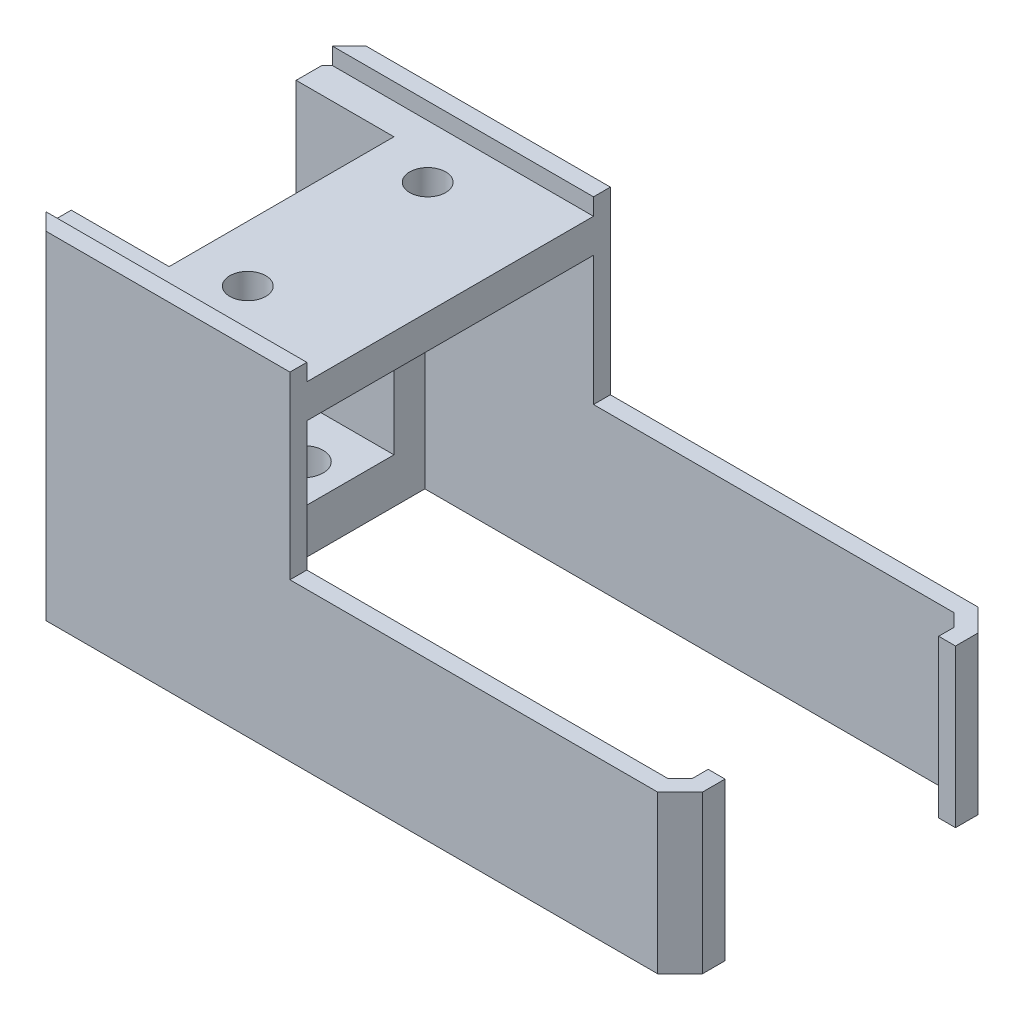
from build123d import *

# Parameters (mm, degrees)
SZKIC1_W                      = 8.7
SZKIC1_H                      = 9
SZKIC1_R                      = 1.75
DODANIE_WYCI_GNI_CIE1_DEPTH   = 2
DODANIE_WYCI_GNI_CIE1_2_DEPTH = 2
SZKIC2_W                      = 8.7
SZKIC2_H                      = 20
SZKIC2_R                      = 1.75
DODANIE_WYCI_GNI_CIE2_DEPTH   = 2
DODANIE_WYCI_GNI_CIE3_DEPTH   = 14
WYTNIJ_WYCI_GNI_CIE1_REACH    = 46.443
DODANIE_WYCI_GNI_CIE7_DEPTH   = 14.5
SZKIC10_W                     = 15
SZKIC10_H                     = 25.5
SZKIC10_R                     = 1.6
DODANIE_WYCI_GNI_CIE9_DEPTH   = 3
DODANIE_WYCI_GNI_CIE10_DEPTH  = 1.5


with BuildPart() as part:
    # Szkic1 → Dodanie-wyciągnięcie1 (new body)
    with BuildSketch(Plane(origin=(0, 0, 0), x_dir=(1, 0, 0), z_dir=(0, 1, 0))):
        with Locations((-35.35, 5.5)):
            Rectangle(SZKIC1_W, SZKIC1_H)
        with Locations(Location((-34.5, 5.45, 0), (0, 0, 270))):
            Circle(SZKIC1_R, mode=Mode.SUBTRACT)
    extrude(amount=DODANIE_WYCI_GNI_CIE1_DEPTH)



with BuildPart() as body_2:
    # Szkic1 → Dodanie-wyci_gni_cie1 2 (new body)
    with BuildSketch(Plane(origin=(0, 0, 0), x_dir=(1, 0, 0), z_dir=(0, 1, 0))):
        with Locations((-35.35, -5.5)):
            Rectangle(SZKIC1_W, SZKIC1_H)
        with Locations(Location((-34.5, -5.45, 0), (0, 0, 90))):
            Circle(SZKIC1_R, mode=Mode.SUBTRACT)
    extrude(amount=DODANIE_WYCI_GNI_CIE1_2_DEPTH)


with BuildPart() as part_1:
    add(part.part)

    add(body_2.part)  # Dodanie-wyciągnięcie2 merges body 2
    # Szkic2 → Dodanie-wyciągnięcie2 (add)
    with BuildSketch(Plane(origin=(0, 2, 0), x_dir=(1, 0, 0), z_dir=(0, 1, 0))):
        with Locations((-35.35, 0)):
            Rectangle(SZKIC2_W, SZKIC2_H)
        with Locations(Location((-34.5, 5.45, 0), (0, 0, 270))):
            Circle(SZKIC2_R, mode=Mode.SUBTRACT)
        with Locations(Location((-34.5, -5.45, 0), (0, 0, 90))):
            Circle(SZKIC2_R, mode=Mode.SUBTRACT)
    extrude(amount=DODANIE_WYCI_GNI_CIE2_DEPTH)

    # Szkic5 → Dodanie-wyciągnięcie3 (add)
    with BuildSketch(Plane(origin=(0, 0, 0), x_dir=(-1, 0, 0), z_dir=(0, -1, 0))):
        Polygon((39.7, -10), (39.7, -12.25), (37.7, -14.25), (-16.7, -14.25), (-18.7, -12.25), (-18.7, -10.25), (31, -10.25), (31, -10), align=None)
        Polygon((39.7, 10), (39.7, 12.25), (37.7, 14.25), (-16.7, 14.25), (-18.7, 12.25), (-18.7, 10.25), (31, 10.25), (31, 10), align=None)
    extrude(amount=-DODANIE_WYCI_GNI_CIE3_DEPTH)

    # Szkic7 → Wytnij-wyciągnięcie1 (cut, up to next)
    with BuildSketch(Plane(origin=(0, 14, 0), x_dir=(1, 0, 0), z_dir=(0, 1, 0)), mode=Mode.PRIVATE) as wytnij_wyci_gni_cie1_sk1:
        Polygon((-31, 10.25), (17.2, 10.25), (17.2, 11.628679656), (16.078679656, 12.75), (-31, 12.75), align=None)
    wytnij_wyci_gni_cie1_tool1 = extrude(wytnij_wyci_gni_cie1_sk1.sketch, amount=-WYTNIJ_WYCI_GNI_CIE1_REACH, mode=Mode.PRIVATE) & part_1.part
    # Szkic7 → Wytnij-wyciągnięcie1 (cut, up to next)
    with BuildSketch(Plane(origin=(0, 14, 0), x_dir=(1, 0, 0), z_dir=(0, 1, 0)), mode=Mode.PRIVATE) as wytnij_wyci_gni_cie1_sk2:
        Polygon((16.078679656, -12.75), (-31, -12.75), (-31, -10.25), (17.2, -10.25), (17.2, -11.628679656), align=None)
    wytnij_wyci_gni_cie1_tool2 = extrude(wytnij_wyci_gni_cie1_sk2.sketch, amount=-WYTNIJ_WYCI_GNI_CIE1_REACH, mode=Mode.PRIVATE) & part_1.part
    add(wytnij_wyci_gni_cie1_tool1.solids().sort_by_distance((-7.024435, 14, -11.495405))[0], mode=Mode.SUBTRACT)
    add(wytnij_wyci_gni_cie1_tool2.solids().sort_by_distance((-7.024435, 14, 11.495405))[0], mode=Mode.SUBTRACT)

    # Szkic8 → Dodanie-wyciągnięcie7 (add)
    with BuildSketch(Plane(origin=(0, 14, 0), x_dir=(1, 0, 0), z_dir=(0, 1, 0))):
        Polygon((-31, 10), (-39.7, 10), (-39.7, 12.25), (-37.7, 14.25), (-16, 14.25), (-16, 12.75), (-31, 12.75), align=None)
        Polygon((-16, -12.75), (-31, -12.75), (-31, -10), (-39.7, -10), (-39.7, -12.25), (-37.7, -14.25), (-16, -14.25), align=None)
    extrude(amount=DODANIE_WYCI_GNI_CIE7_DEPTH)

    # Szkic10 → Dodanie-wyciągnięcie9 (add)
    with BuildSketch(Plane(origin=(0, 28.5, 0), x_dir=(1, 0, 0), z_dir=(0, 1, 0))):
        with Locations((-23.5, 0)):
            Rectangle(SZKIC10_W, SZKIC10_H)
        with Locations(Location((-26, 8, 0), (0, 0, 270))):
            Circle(SZKIC10_R, mode=Mode.SUBTRACT)
        with Locations(Location((-26, -8, 0), (0, 0, 90))):
            Circle(SZKIC10_R, mode=Mode.SUBTRACT)
    extrude(amount=-DODANIE_WYCI_GNI_CIE9_DEPTH)

    # Szkic11 → Dodanie-wyciągnięcie10 (add)
    with BuildSketch(Plane(origin=(0, 28.5, 0), x_dir=(1, 0, 0), z_dir=(0, 1, 0))):
        Polygon((-16, 12.75), (-16, 14.25), (-37.7, 14.25), (-39.2, 12.75), align=None)
        Polygon((-37.7, -14.25), (-39.2, -12.75), (-16, -12.75), (-16, -14.25), align=None)
    extrude(amount=DODANIE_WYCI_GNI_CIE10_DEPTH)


solid = part_1.part
